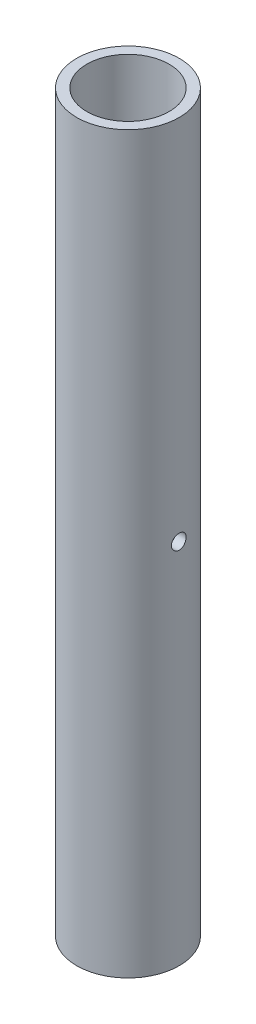
from build123d import *

# Parameters (mm, degrees)
SKETCH2_R                   = 17.45
SKETCH2_R_2                 = 14
BOSS_EXTRUDE1_DEPTH         = 250
TAP_DRILL_FOR_M6X1_0_TAP1_D = 5


with BuildPart() as part:
    # Sketch2 → Boss-Extrude1 (new body)
    with BuildSketch(Plane(origin=(0, 0, 0), x_dir=(1, 0, 0), z_dir=(0, 1, 0))):
        with Locations(Location((0, 0, 0), (0, 0, 270))):
            Circle(SKETCH2_R)
        with Locations(Location((0, 0, 0), (0, 0, 270))):
            Circle(SKETCH2_R_2, mode=Mode.SUBTRACT)
    extrude(amount=-BOSS_EXTRUDE1_DEPTH)

    # Tap Drill for M6x1.0 Tap1 (through all)
    with Locations(Plane(origin=(17.45, 0, 0), x_dir=(0, 0, -1), z_dir=(1, 0, 0))):
        with Locations((0, -125)):
            Hole(TAP_DRILL_FOR_M6X1_0_TAP1_D / 2)


solid = part.part
